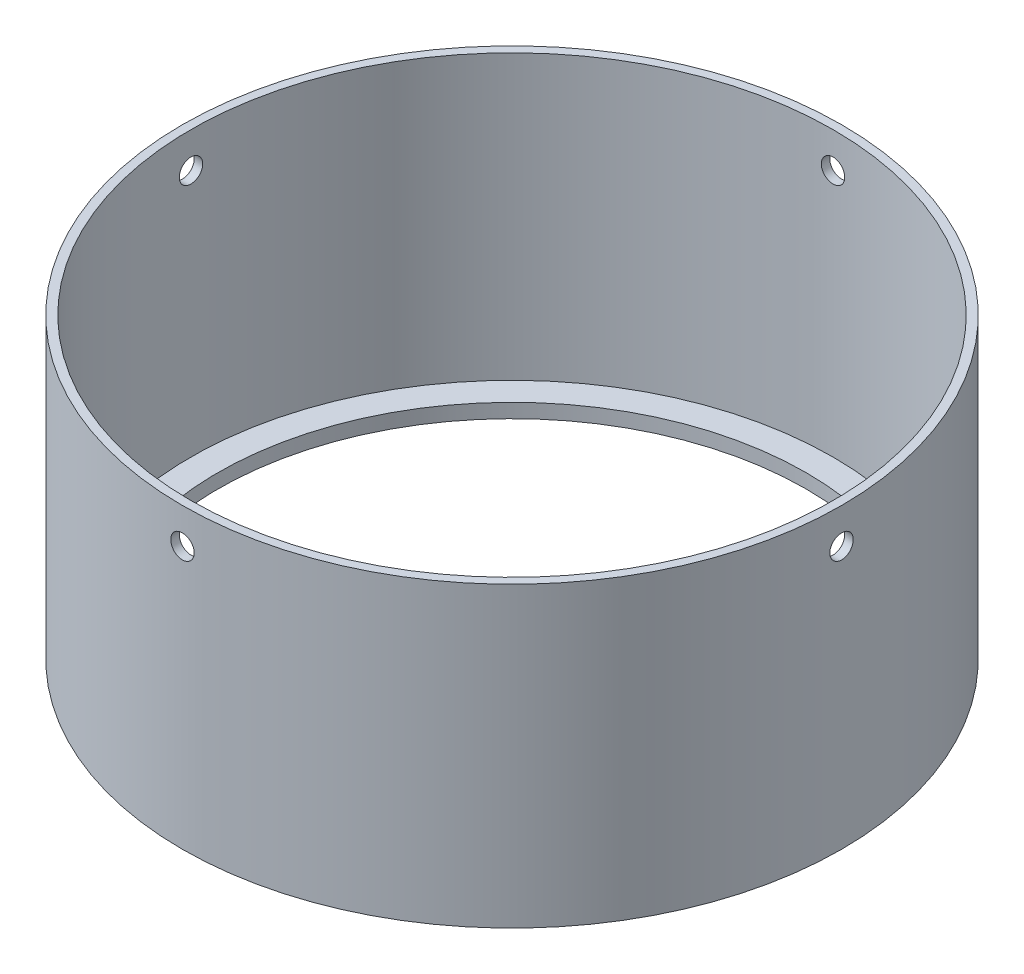
from build123d import *

# Parameters (mm, degrees)
SKETCH1_R           = 46.5
SKETCH1_R_2         = 45.3
BOSS_EXTRUDE1_DEPTH = 40
SKETCH2_R           = 1.65
CUT_EXTRUDE1_DEPTH  = 77.970773674
CIRPATTERN1_COUNT   = 4
BOSS_EXTRUDE2_START = 2
SKETCH3_R           = 46.5
SKETCH3_R_2         = 41.5
BOSS_EXTRUDE2_DEPTH = 2


with BuildPart() as part:
    # Sketch1 → Boss-Extrude1 (new body)
    with BuildSketch(Plane(origin=(0, 0, 0), x_dir=(1, 0, 0), z_dir=(0, 1, 0))):
        with Locations(Location((0, 0, 0), (0, 0, 270))):
            Circle(SKETCH1_R)
        with Locations(Location((0, 0, 0), (0, 0, 270))):
            Circle(SKETCH1_R_2, mode=Mode.SUBTRACT)
    extrude(amount=BOSS_EXTRUDE1_DEPTH)

    # Sketch2 → Cut-Extrude1 (cut, through all)
    with BuildSketch(Plane(origin=(0, 0, 0), x_dir=(0, 0, -1), z_dir=(1, 0, 0))):
        with Locations((0, 35)):
            Circle(SKETCH2_R)
    cut_extrude1 = extrude(amount=-CUT_EXTRUDE1_DEPTH, mode=Mode.SUBTRACT)

    # CirPattern1: Cut-Extrude1 ×4 about axis
    cirpattern1_axis = Axis((0, 40, 0), (0, -1, 0))
    for i in range(1, CIRPATTERN1_COUNT):
        add(cut_extrude1.rotate(cirpattern1_axis, i * 360 / CIRPATTERN1_COUNT), mode=Mode.SUBTRACT)

    # Sketch3 → Boss-Extrude2 (add)
    with BuildSketch(Plane.XZ.offset(BOSS_EXTRUDE2_START)):
        with Locations(Location((0, 0, 0), (0, 0, 270))):
            Circle(SKETCH3_R)
        with Locations(Location((0, 0, 0), (0, 0, 270))):
            Circle(SKETCH3_R_2, mode=Mode.SUBTRACT)
    extrude(amount=-BOSS_EXTRUDE2_DEPTH)


solid = part.part
